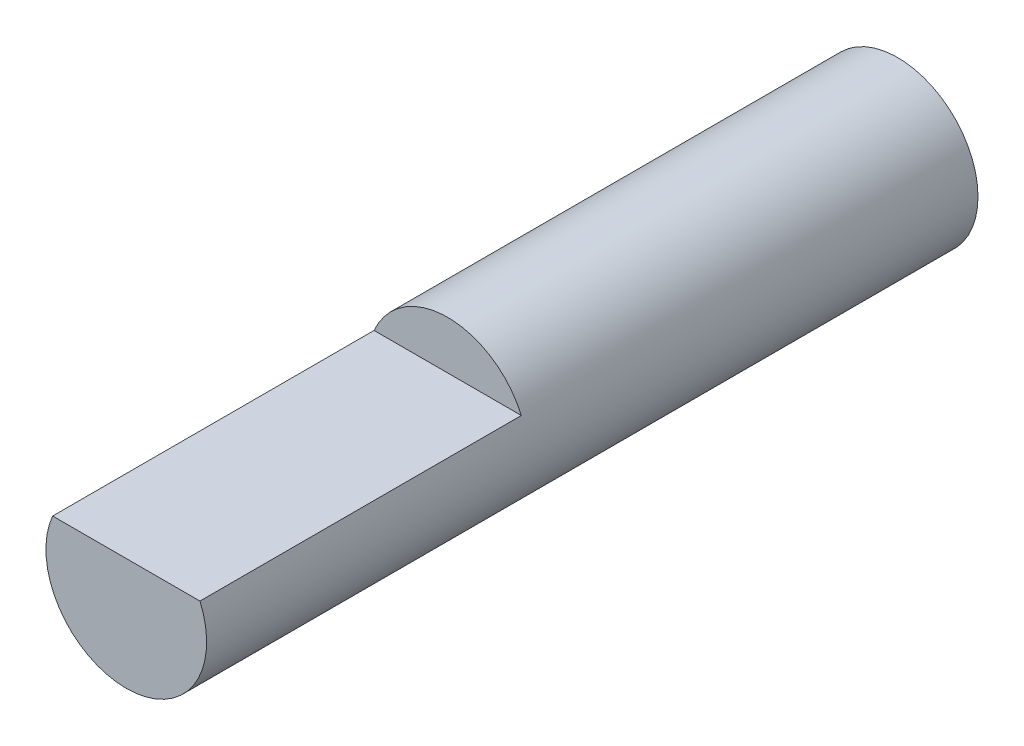
from build123d import *

# Parameters (mm, degrees)
CROQUIS2_R              = 2.5
SALIENTE_EXTRUIR1_DEPTH = 24
CORTAR_EXTRUIR1_START   = -10
CORTAR_EXTRUIR1_DEPTH   = 10


with BuildPart() as part:
    # Croquis2 → Saliente-Extruir1 (new body)
    with BuildSketch(Plane.XY):
        Circle(CROQUIS2_R)
    extrude(amount=SALIENTE_EXTRUIR1_DEPTH)

    # Croquis3 → Cortar-Extruir1 (cut)
    with BuildSketch(Plane.XY.offset(24).offset(CORTAR_EXTRUIR1_START)):
        with BuildLine():
            Line((-2.291287847, 1), (2.291287847, 1))
            ThreePointArc((2.291287847, 1), (0, 2.5), (-2.291287847, 1))
        make_face()
    extrude(amount=CORTAR_EXTRUIR1_DEPTH, mode=Mode.SUBTRACT)


solid = part.part
